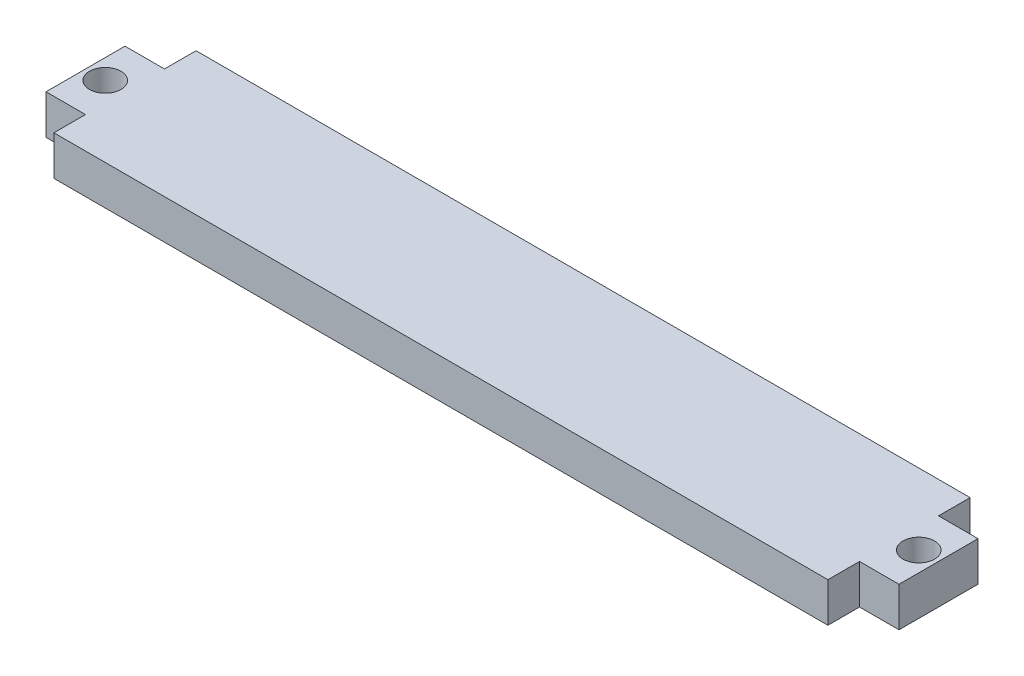
from build123d import *

# Parameters (mm, degrees)
SKETCH1_R           = 2
BOSS_EXTRUDE1_DEPTH = 5


with BuildPart() as part:
    # Sketch1 → Boss-Extrude1 (new body)
    with BuildSketch(Plane(origin=(0, 0, 0), x_dir=(1, 0, 0), z_dir=(0, 1, 0))):
        Polygon((-48.873772791, 17.032258065), (49.126227209, 17.032258065), (49.126227209, 13.032258065), (54.126227209, 13.032258065), (54.126227209, 3.032258065), (49.126227209, 3.032258065), (49.126227209, -0.967741935), (-48.873772791, -0.967741935), (-48.873772791, 3.032258065), (-53.873772791, 3.032258065), (-53.873772791, 13.032258065), (-48.873772791, 13.032258065), align=None)
        with Locations(Location((51.626227209, 8.032258065, 0), (0, 0, 270))):
            Circle(SKETCH1_R, mode=Mode.SUBTRACT)
        with Locations(Location((-51.373772791, 8.032258065, 0), (0, 0, 270))):
            Circle(SKETCH1_R, mode=Mode.SUBTRACT)
    extrude(amount=BOSS_EXTRUDE1_DEPTH)


solid = part.part
